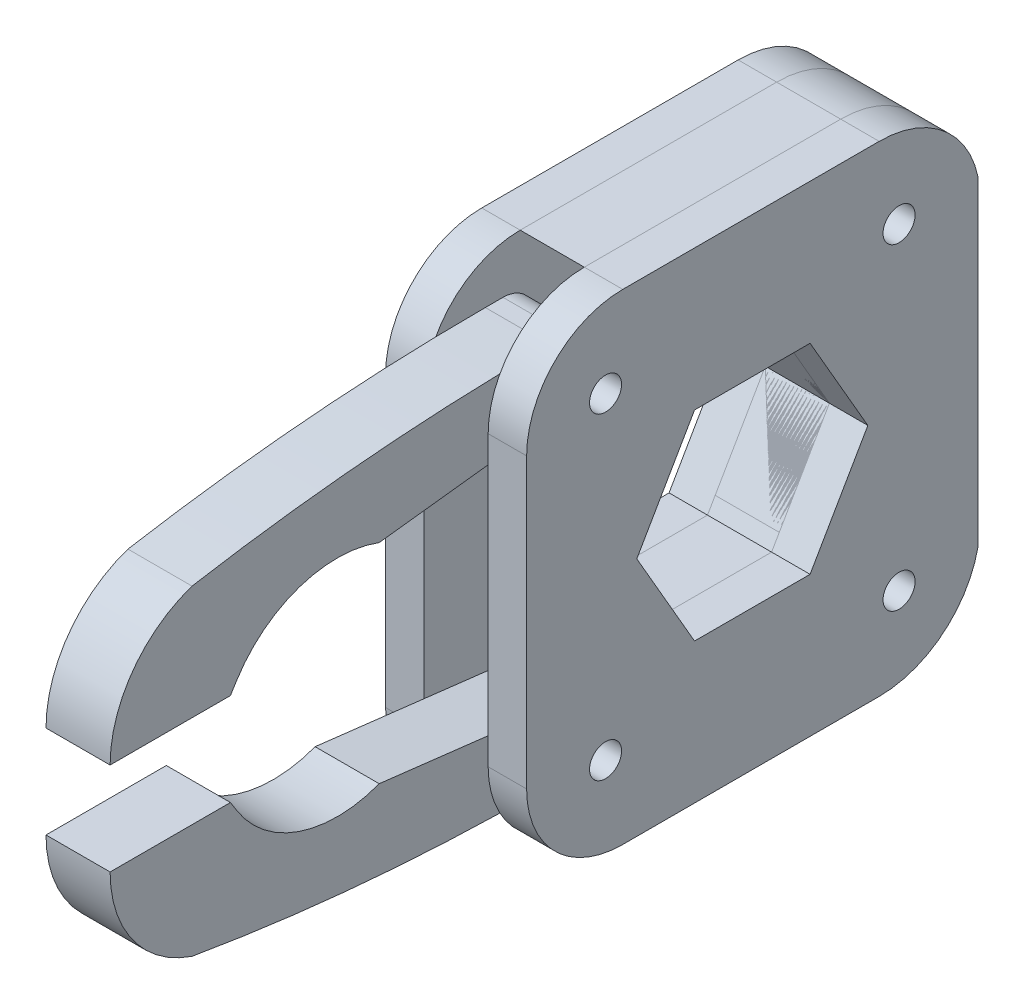
from build123d import *

# Parameters (mm, degrees)
SKETCH1_R               = 10
BOSS_EXTRUDE1_DEPTH     = 10
SKETCH2_W               = 100
SKETCH2_H               = 50
BOSS_EXTRUDE2_DEPTH     = 10
SKETCH3_R               = 5
BOSS_EXTRUDE3_DEPTH     = 12
BOSS_EXTRUDE4_DEPTH     = 12
BOSS_EXTRUDE5_DEPTH     = 20
BOSS_EXTRUDE5_2_DEPTH   = 20
SKETCH8_R               = 5
CUT_EXTRUDE4_DEPTH      = 283.504352274
SKETCH9_W               = 5
SKETCH9_H               = 5
CUT_EXTRUDE6_DEPTH      = 10
BOSS_EXTRUDE6_DEPTH     = 20
CUT_EXTRUDE5_DEPTH      = 283.504352274
LPATTERN1_COUNT         = 2
LPATTERN1_PITCH         = 91.582479795
CUT_EXTRUDE7_DEPTH      = 281.885580003
CUT_EXTRUDE7_DEPTH_BACK = 281.885580003
SKETCH12_R              = 5
BODY_MOVE_COPY1_ANGLE   = 90


with BuildPart() as part:
    # Sketch1 → Boss-Extrude1 (new body)
    with BuildSketch(Plane.YZ):
        with Locations(Location((0, 0, 0), (0, 0, 270))):
            Circle(SKETCH1_R)
    extrude(amount=-BOSS_EXTRUDE1_DEPTH)

    # Sketch2 → Boss-Extrude2 (add, symmetric)
    with BuildSketch(Plane(origin=(0, 0, 0), x_dir=(0, 1, 0), z_dir=(0, 0, 1))):
        with Locations((0, 35)):
            Rectangle(SKETCH2_W, SKETCH2_H)
    extrude(amount=BOSS_EXTRUDE2_DEPTH, both=True)

    # Sketch9 → Cut-Extrude6 (cut)
    with BuildSketch(Plane.YZ):
        Rectangle(SKETCH9_W, SKETCH9_H)
    extrude(amount=-CUT_EXTRUDE6_DEPTH, mode=Mode.SUBTRACT)


with BuildPart() as body_2:
    # Sketch3 → Boss-Extrude3 (new body)
    with BuildSketch(Plane.XY.offset(10)):
        with BuildLine():
            Line((-150.831969836, 45), (-150.831969836, -45))
            ThreePointArc((-150.831969836, -45), (-142.045173272, -66.213203436), (-120.831969836, -75))
            Line((-120.831969836, -75), (-40.831969836, -75))
            ThreePointArc((-40.831969836, -75), (-20.984990444, -67.964651519), (-10, -50))
            Line((-10, -50), (-10, 50))
            ThreePointArc((-10, 50), (-20.984990444, 67.964651519), (-40.831969836, 75))
            Line((-40.831969836, 75), (-120.831969836, 75))
            ThreePointArc((-120.831969836, 75), (-142.045173272, 66.213203436), (-150.831969836, 45))
        make_face()
        with Locations(Location((-126.207224816, 49.528233971, 0), (0, 0, 180))):
            Circle(SKETCH3_R, mode=Mode.SUBTRACT)
        with Locations(Location((-126.207224816, -49.528233971, 0), (0, 0, 180))):
            Circle(SKETCH3_R, mode=Mode.SUBTRACT)
    extrude(amount=BOSS_EXTRUDE3_DEPTH)


with BuildPart() as body_3:
    # Sketch4 → Boss-Extrude4 (new body)
    with BuildSketch(Plane(origin=(0, 0, -10), x_dir=(1, 0, 0), z_dir=(0, 0, -1))):
        with BuildLine():
            Line((-120.831969836, -75), (-40.831969836, -75))
            ThreePointArc((-40.831969836, -75), (-20.984990444, -67.964651519), (-10, -50))
            Line((-10, -50), (-60, -50))
            Line((-60, -50), (-60, 50))
            Line((-60, 50), (-10, 50))
            ThreePointArc((-10, 50), (-20.984990444, 67.964651519), (-40.831969836, 75))
            Line((-40.831969836, 75), (-120.831969836, 75))
            ThreePointArc((-120.831969836, 75), (-142.045173272, 66.213203436), (-150.831969836, 45))
            Line((-150.831969836, 45), (-150.831969836, -45))
            ThreePointArc((-150.831969836, -45), (-142.045173272, -66.213203436), (-120.831969836, -75))
        make_face()
        Polygon((-10, 0), (-10, 50), (-60, 50), (-60, -50), (-10, -50), align=None)
    extrude(amount=BOSS_EXTRUDE4_DEPTH)


with BuildPart() as body_4:
    # Sketch6 → Boss-Extrude5 (new body)
    with BuildSketch(Plane(origin=(0, 0, 10), x_dir=(1, 0, 0), z_dir=(0, 0, -1))):
        with BuildLine():
            Line((-126.207224816, -39.528233971), (-184.826587206, -32.573634574))
            ThreePointArc((-184.826587206, -32.573634574), (-209.722959414, -33.028609564), (-229.269927416, -17.602903963))
            Line((-229.269927416, -17.602903963), (-231.247893265, -14.444595521))
            Line((-231.247893265, -14.444595521), (-268.789339547, -14.444595521))
            ThreePointArc((-268.789339547, -14.444595521), (-261.73765338, -36.347442757), (-243.231735109, -50.021943983))
            ThreePointArc((-243.231735109, -50.021943983), (-187.67617631, -57.147359493), (-131.71616294, -59.528233971))
            Line((-131.71616294, -59.528233971), (-126.207224816, -59.528233971))
            ThreePointArc((-126.207224816, -59.528233971), (-116.207224816, -49.528233971), (-126.207224816, -39.528233971))
        make_face()
    extrude(amount=BOSS_EXTRUDE5_DEPTH)


with BuildPart() as body_5:
    # Sketch6 → Boss-Extrude5 2 (new body)
    with BuildSketch(Plane(origin=(0, 0, 10), x_dir=(1, 0, 0), z_dir=(0, 0, -1))):
        with BuildLine():
            Line((-231.247893265, 14.444595521), (-229.269927416, 17.602903963))
            ThreePointArc((-229.269927416, 17.602903963), (-209.722959414, 33.028609564), (-184.826587206, 32.573634574))
            Line((-184.826587206, 32.573634574), (-126.207224816, 39.528233971))
            ThreePointArc((-126.207224816, 39.528233971), (-116.207224816, 49.528233971), (-126.207224816, 59.528233971))
            Line((-126.207224816, 59.528233971), (-131.71616294, 59.528233971))
            ThreePointArc((-131.71616294, 59.528233971), (-187.67617631, 57.147359493), (-243.231735109, 50.021943983))
            ThreePointArc((-243.231735109, 50.021943983), (-261.73765338, 36.347442757), (-268.789339547, 14.444595521))
            Line((-268.789339547, 14.444595521), (-231.247893265, 14.444595521))
        make_face()
    extrude(amount=BOSS_EXTRUDE5_2_DEPTH)


with BuildPart() as cut_extrude4_tool:
    # Sketch8 → Cut-Extrude4 (new, symmetric)
    with BuildSketch(Plane.XY.offset(22)):
        with Locations(Location((-126.207224816, -49.528233971, 0), (0, 0, 180))):
            Circle(SKETCH8_R)
        with Locations(Location((-126.207224816, 49.528233971, 0), (0, 0, 180))):
            Circle(SKETCH8_R)
    cut_extrude4 = extrude(amount=CUT_EXTRUDE4_DEPTH, both=True)


with BuildPart() as body_3_1:
    add(body_3.part)

    # Cut-Extrude4: cut by cut_extrude4_tool
    add(cut_extrude4_tool.part, mode=Mode.SUBTRACT)


with BuildPart() as body_4_1:
    add(body_4.part)

    # Cut-Extrude4: cut by cut_extrude4_tool
    add(cut_extrude4_tool.part, mode=Mode.SUBTRACT)


with BuildPart() as body_5_1:
    add(body_5.part)

    # Cut-Extrude4: cut by cut_extrude4_tool
    add(cut_extrude4_tool.part, mode=Mode.SUBTRACT)


with BuildPart() as body_6:
    # Sketch11 → Boss-Extrude6 (new body)
    with BuildSketch(Plane.YX.offset(-10)):
        with BuildLine():
            Line((23.495480933, -126.207224816), (-23.495480933, -126.207224816))
            ThreePointArc((-23.495480933, -126.207224816), (-46.826009308, -100.315098356), (-75, -120.831969836))
            Line((-75, -120.831969836), (-75, -40.831969836))
            ThreePointArc((-75, -40.831969836), (-67.964651519, -20.984990444), (-50, -10))
            Line((-50, -10), (50, -10))
            ThreePointArc((50, -10), (67.964651519, -20.984990444), (75, -40.831969836))
            Line((75, -40.831969836), (75, -120.831969836))
            ThreePointArc((75, -120.831969836), (46.826009308, -100.315098356), (23.495480933, -126.207224816))
        make_face()
    extrude(amount=BOSS_EXTRUDE6_DEPTH)


with BuildPart() as cut_extrude5_tool:
    # Sketch7 → Cut-Extrude5 (new, through all)
    with BuildSketch(Plane.XY.offset(22)):
        Polygon((-98.43843477, -31.21579882), (-62.393535066, -31.21579882), (-44.371085215, 0), (-62.393535066, 31.21579882), (-98.43843477, 31.21579882), (-116.460884622, 0), align=None)
    extrude(amount=-CUT_EXTRUDE5_DEPTH)


with BuildPart() as part_1:
    add(part.part)

    # Cut-Extrude5: cut by cut_extrude5_tool
    add(cut_extrude5_tool.part, mode=Mode.SUBTRACT)


with BuildPart() as body_2_1:
    add(body_2.part)

    # Cut-Extrude5: cut by cut_extrude5_tool
    add(cut_extrude5_tool.part, mode=Mode.SUBTRACT)


with BuildPart() as body_3_2:
    add(body_3_1.part)

    # Cut-Extrude5: cut by cut_extrude5_tool
    add(cut_extrude5_tool.part, mode=Mode.SUBTRACT)


with BuildPart() as body_6_1:
    add(body_6.part)

    # Cut-Extrude5: cut by cut_extrude5_tool
    add(cut_extrude5_tool.part, mode=Mode.SUBTRACT)

    # Sketch12 → Cut-Extrude7 (cut, two sides: drawn at the far end of the back side and taken through both)
    with BuildSketch(Plane(origin=(0, 0, -10), x_dir=(1, 0, 0), z_dir=(0, 0, -1)).offset(-CUT_EXTRUDE7_DEPTH_BACK)):
        with Locations(Location((-34.624745021, -49.528233971, 0), (0, 0, 180))):
            Circle(SKETCH12_R)
        with Locations(Location((-34.624745021, 49.528233971, 0), (0, 0, 180))):
            Circle(SKETCH12_R)
    extrude(amount=CUT_EXTRUDE7_DEPTH + CUT_EXTRUDE7_DEPTH_BACK, mode=Mode.SUBTRACT)


with BuildPart() as lpattern1_tool:
    # LPattern1: Cut-Extrude4 ×2
    with Locations(*[(i * LPATTERN1_PITCH, 0, 0) for i in range(1, LPATTERN1_COUNT)]):
        add(cut_extrude4)


with BuildPart() as body_2_2:
    add(body_2_1.part)

    # LPattern1: cut by lpattern1_tool
    add(lpattern1_tool.part, mode=Mode.SUBTRACT)


with BuildPart() as part_2:
    add(part_1.part)

    # LPattern1: cut by lpattern1_tool
    add(lpattern1_tool.part, mode=Mode.SUBTRACT)


with BuildPart() as body_3_3:
    add(body_3_2.part)

    # LPattern1: cut by lpattern1_tool
    add(lpattern1_tool.part, mode=Mode.SUBTRACT)


with BuildPart() as part_3:
    # Body-Move/Copy1: moved
    add(part_2.part.rotate(Axis((0, 0, 0), (0, 1, 0)), BODY_MOVE_COPY1_ANGLE))


with BuildPart() as body_5_2:
    # Body-Move/Copy1: moved
    add(body_5_1.part.rotate(Axis((0, 0, 0), (0, 1, 0)), BODY_MOVE_COPY1_ANGLE))


with BuildPart() as body_3_4:
    # Body-Move/Copy1: moved
    add(body_3_3.part.rotate(Axis((0, 0, 0), (0, 1, 0)), BODY_MOVE_COPY1_ANGLE))


with BuildPart() as body_4_2:
    # Body-Move/Copy1: moved
    add(body_4_1.part.rotate(Axis((0, 0, 0), (0, 1, 0)), BODY_MOVE_COPY1_ANGLE))


with BuildPart() as body_2_3:
    # Body-Move/Copy1: moved
    add(body_2_2.part.rotate(Axis((0, 0, 0), (0, 1, 0)), BODY_MOVE_COPY1_ANGLE))


with BuildPart() as body_6_2:
    # Body-Move/Copy1: moved
    add(body_6_1.part.rotate(Axis((0, 0, 0), (0, 1, 0)), BODY_MOVE_COPY1_ANGLE))


solid = Compound([part_3.part, body_5_2.part, body_3_4.part, body_4_2.part, body_2_3.part, body_6_2.part])
